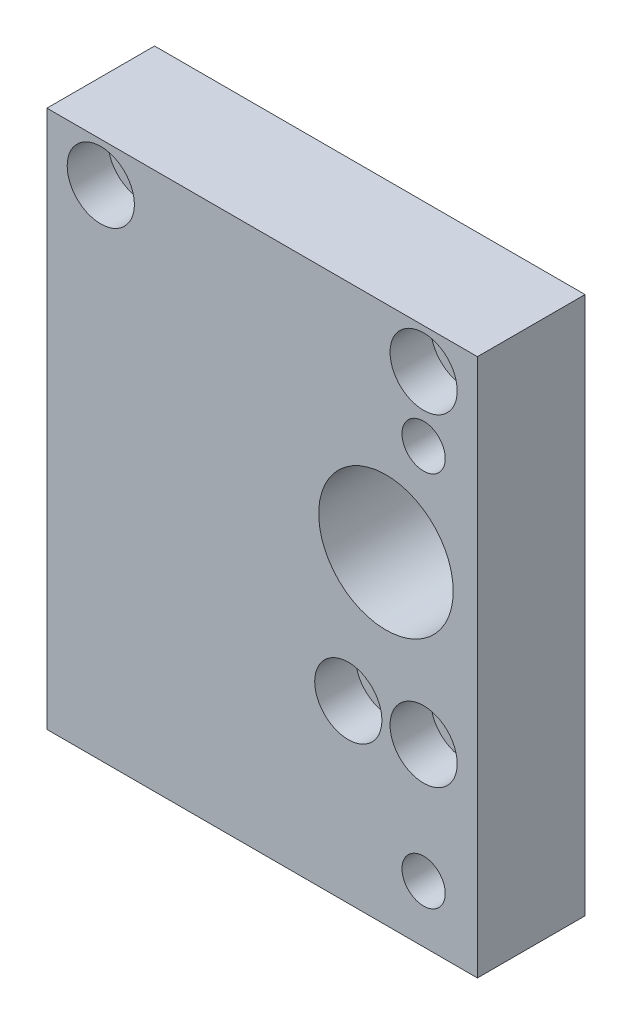
from build123d import *

# Parameters (mm, degrees)
SKETCH1_W                                       = 50.8
SKETCH1_H                                       = 50.8
SKETCH1_R                                       = 2.5527
SKETCH1_R_2                                     = 7.9375
BOSS_EXTRUDE1_DEPTH                             = 12.7
SKETCH2_W                                       = 50.8
SKETCH2_H                                       = 12.7
BOSS_EXTRUDE2_DEPTH                             = 12.7
CBORE_FOR_10_SOCKET_HEAD_CAP_SCREW1_D           = 5.1054
CBORE_FOR_10_SOCKET_HEAD_CAP_SCREW1_CBORE_D     = 7.9248
CBORE_FOR_10_SOCKET_HEAD_CAP_SCREW1_CBORE_DEPTH = 4.826
SKETCH6_R                                       = 3.9624
CUT_EXTRUDE1_DEPTH                              = 4.826


with BuildPart() as part:
    # Sketch1 → Boss-Extrude1 (new body)
    with BuildSketch(Plane.XY):
        Rectangle(SKETCH1_W, SKETCH1_H)
        with Locations(Location((-19.05, 20.701, 0), (0, 0, 180))):
            Circle(SKETCH1_R, mode=Mode.SUBTRACT)
        with Locations((19.05, 20.701)):
            Circle(SKETCH1_R, mode=Mode.SUBTRACT)
        with Locations((19.05, -17.399)):
            Circle(SKETCH1_R, mode=Mode.SUBTRACT)
        with Locations((10.16, -17.399)):
            Circle(SKETCH1_R, mode=Mode.SUBTRACT)
        with Locations((14.605, 0)):
            Circle(SKETCH1_R_2, mode=Mode.SUBTRACT)
    extrude(amount=BOSS_EXTRUDE1_DEPTH)

    # Sketch2 → Boss-Extrude2 (add)
    with BuildSketch(Plane.XZ.offset(25.4)):
        with Locations((0, 6.35)):
            Rectangle(SKETCH2_W, SKETCH2_H)
    extrude(amount=BOSS_EXTRUDE2_DEPTH)

    # CBORE for #10 Socket Head Cap Screw1 (through all)
    with Locations(Plane(origin=(-24.721209515, -12.864288698, 0), x_dir=(1, 0, 0), z_dir=(0, 0, -1))):
        with Locations((43.771209515, 18.504711302), (43.771209515, -25.945288698)):
            CounterBoreHole(CBORE_FOR_10_SOCKET_HEAD_CAP_SCREW1_D / 2, CBORE_FOR_10_SOCKET_HEAD_CAP_SCREW1_CBORE_D / 2, CBORE_FOR_10_SOCKET_HEAD_CAP_SCREW1_CBORE_DEPTH)

    # Sketch6 → Cut-Extrude1 (cut)
    with BuildSketch(Plane(origin=(0, 0, 12.7), x_dir=(-1, 0, 0), z_dir=(0, 0, -1))):
        with Locations((-19.05, 20.701)):
            Circle(SKETCH6_R)
        with Locations((-19.05, -17.399)):
            Circle(SKETCH6_R)
        with Locations((-10.16, -17.399)):
            Circle(SKETCH6_R)
        with Locations((19.05, 20.701)):
            Circle(SKETCH6_R)
    extrude(amount=CUT_EXTRUDE1_DEPTH, mode=Mode.SUBTRACT)


solid = part.part
